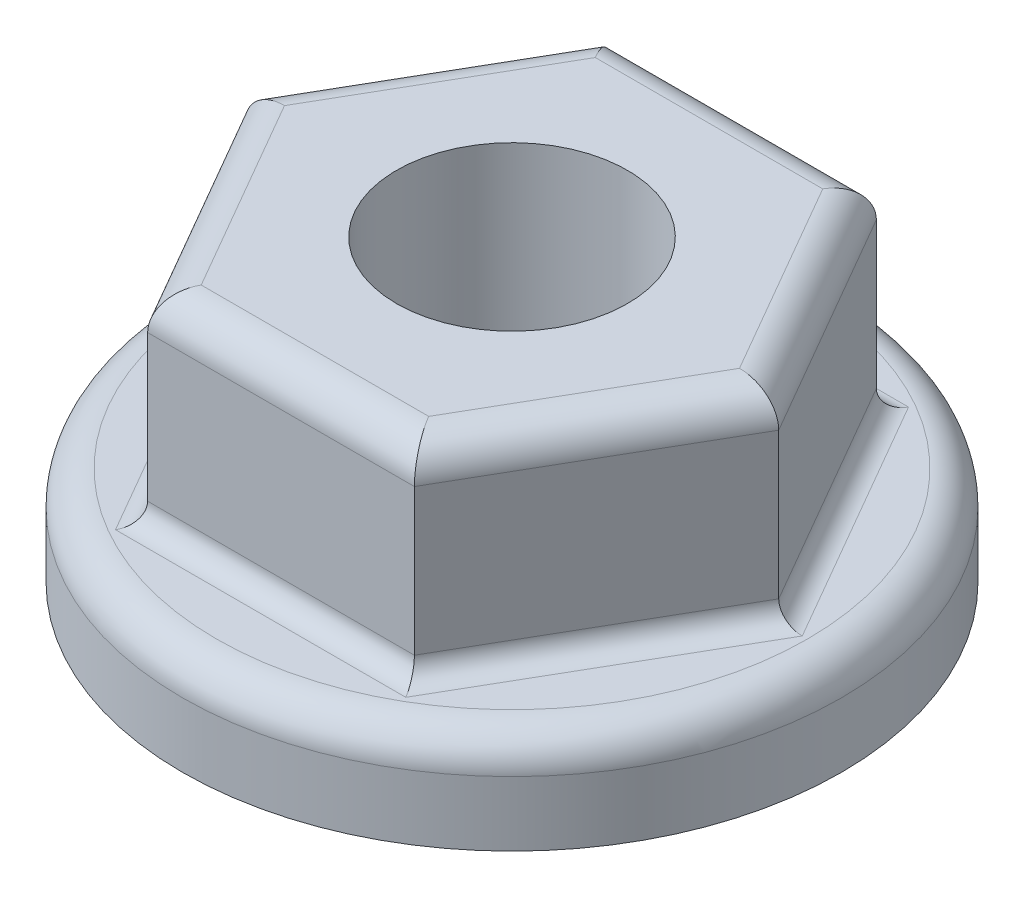
from build123d import *

# Parameters (mm, degrees)
SKETCH_1_R          = 4.85
EXTRUDE_1_DEPTH     = 1.45
EXTRUDE_2_DEPTH     = 2.95
SKETCH_3_R          = 1.7
CUT_EXTRUDE_1_DEPTH = 39.592535488
FILLET_1_R          = 0.5
FILLET_2_R          = 0.5
FILLET_3_R          = 0.3


with BuildPart() as part:
    # 草图1 → 凸台-拉伸1 (new body)
    with BuildSketch(Plane(origin=(0, 0, 0), x_dir=(1, 0, 0), z_dir=(0, 1, 0))):
        with Locations(Location((33.182897542, 0, 0), (0, 0, 270))):
            Circle(SKETCH_1_R)
    extrude(amount=EXTRUDE_1_DEPTH)

    # 草图2 → 凸台-拉伸2 (add)
    with BuildSketch(Plane(origin=(0, 1.45, 0), x_dir=(1, 0, 0), z_dir=(0, 1, 0))):
        Polygon((37.108879372, 0), (35.145888457, 3.4), (31.219906626, 3.4), (29.256915711, 0), (31.219906626, -3.4), (35.145888457, -3.4), align=None)
    extrude(amount=EXTRUDE_2_DEPTH)

    # 草图3 → 切除-拉伸1 (cut, through all)
    with BuildSketch(Plane(origin=(0, 4.4, 0), x_dir=(1, 0, 0), z_dir=(0, 1, 0))):
        with Locations(Location((33.182897542, 0, 0), (0, 0, 270))):
            Circle(SKETCH_3_R)
    extrude(amount=-CUT_EXTRUDE_1_DEPTH, mode=Mode.SUBTRACT)

    # 圆角1
    fillet_1_edges = [part.edges().sort_by_distance(p)[0] for p in [
        (36.127383914, 4.4, 1.7),
        (36.127383914, 4.4, -1.7),
        (33.182897542, 4.4, -3.4),
        (30.238411169, 4.4, -1.7),
        (30.238411169, 4.4, 1.7),
        (33.182897542, 4.4, 3.4),
    ]]
    fillet(fillet_1_edges, radius=FILLET_1_R)

    # 圆角2
    fillet_2_edges = [part.edges().sort_by_distance(p)[0] for p in [
        (33.182897542, 1.45, -4.85),
    ]]
    fillet(fillet_2_edges, radius=FILLET_2_R)

    # 圆角3
    fillet_3_edges = [part.edges().sort_by_distance(p)[0] for p in [
        (36.127383914, 1.45, 1.7),
        (36.127383914, 1.45, -1.7),
        (33.182897542, 1.45, -3.4),
        (30.238411169, 1.45, -1.7),
        (30.238411169, 1.45, 1.7),
        (33.182897542, 1.45, 3.4),
    ]]
    fillet(fillet_3_edges, radius=FILLET_3_R)


solid = part.part
